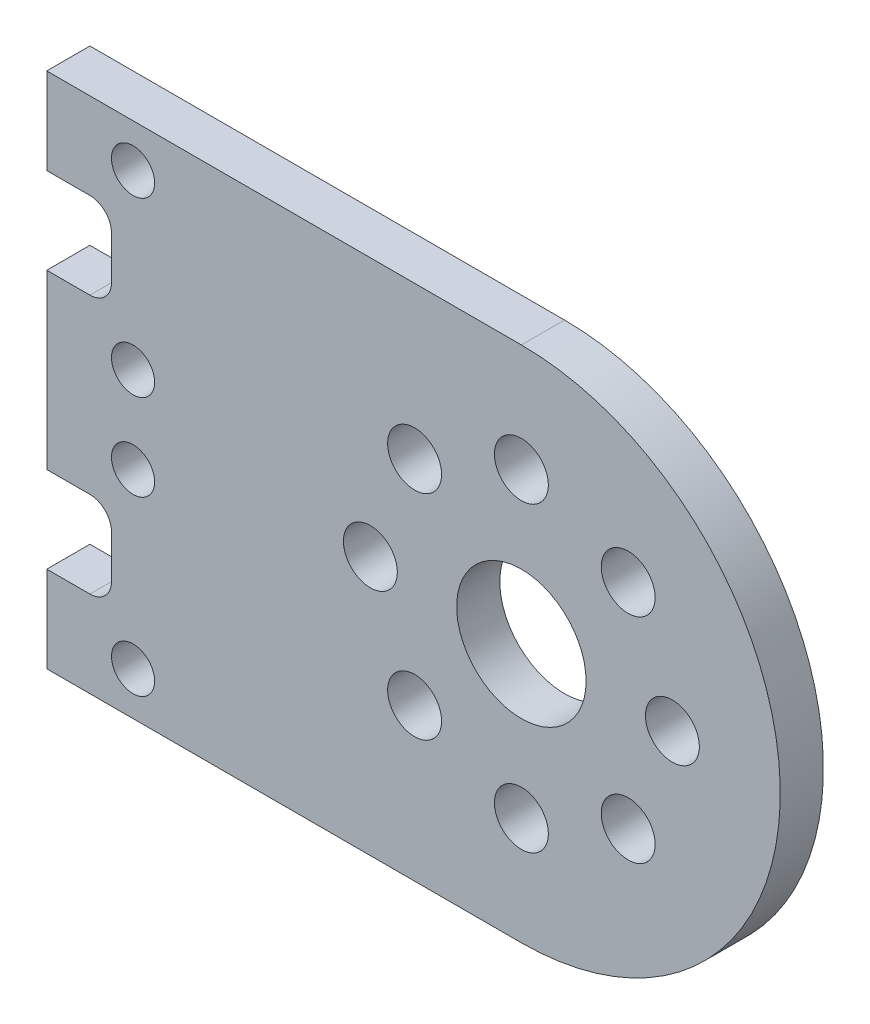
from build123d import *

# Parameters (mm, degrees)
SKETCH_8_R      = 1.25
SKETCH_8_R_2    = 3
SKETCH_8_R_3    = 1
EXTRUDE_1_DEPTH = 2


with BuildPart() as part:
    # 草圖8 → 填料-伸長1 (new body)
    with BuildSketch(Plane.XY):
        with BuildLine():
            Line((-25.40478598, 11.861352689), (-25.40478598, 7.861352689))
            Line((-25.40478598, 7.861352689), (-23.40478598, 7.861352689))
            ThreePointArc((-23.40478598, 7.861352689), (-22.697679198, 7.56845947), (-22.40478598, 6.861352689))
            Line((-22.40478598, 6.861352689), (-22.40478598, 4.861352689))
            ThreePointArc((-22.40478598, 4.861352689), (-22.697679198, 4.154245908), (-23.40478598, 3.861352689))
            Line((-23.40478598, 3.861352689), (-25.40478598, 3.861352689))
            Line((-25.40478598, 3.861352689), (-25.40478598, -4.138647311))
            Line((-25.40478598, -4.138647311), (-23.40478598, -4.138647311))
            ThreePointArc((-23.40478598, -4.138647311), (-22.697679198, -4.43154053), (-22.40478598, -5.138647311))
            Line((-22.40478598, -5.138647311), (-22.40478598, -7.138647311))
            ThreePointArc((-22.40478598, -7.138647311), (-22.697679198, -7.845754092), (-23.40478598, -8.138647311))
            Line((-23.40478598, -8.138647311), (-25.40478598, -8.138647311))
            Line((-25.40478598, -8.138647311), (-25.40478598, -12.138647311))
            Line((-25.40478598, -12.138647311), (-3.40478598, -12.138647311))
            ThreePointArc((-3.40478598, -12.138647311), (8.59521402, -0.138647311), (-3.40478598, 11.861352689))
            Line((-3.40478598, 11.861352689), (-25.40478598, 11.861352689))
        make_face()
        with Locations((-3.40478598, 6.861352689)):
            Circle(SKETCH_8_R, mode=Mode.SUBTRACT)
        with Locations((1.544961489, 4.811100157)):
            Circle(SKETCH_8_R, mode=Mode.SUBTRACT)
        with Locations((-3.40478598, -0.138647311)):
            Circle(SKETCH_8_R_2, mode=Mode.SUBTRACT)
        with Locations((3.59521402, -0.138647311)):
            Circle(SKETCH_8_R, mode=Mode.SUBTRACT)
        with Locations((1.544961489, -5.08839478)):
            Circle(SKETCH_8_R, mode=Mode.SUBTRACT)
        with Locations((-3.40478598, -7.138647311)):
            Circle(SKETCH_8_R, mode=Mode.SUBTRACT)
        with Locations((-8.354533448, -5.08839478)):
            Circle(SKETCH_8_R, mode=Mode.SUBTRACT)
        with Locations((-10.40478598, -0.138647311)):
            Circle(SKETCH_8_R, mode=Mode.SUBTRACT)
        with Locations((-8.354533448, 4.811100157)):
            Circle(SKETCH_8_R, mode=Mode.SUBTRACT)
        with Locations((-21.40478598, 9.861352689)):
            Circle(SKETCH_8_R_3, mode=Mode.SUBTRACT)
        with Locations((-21.40478598, 1.861352689)):
            Circle(SKETCH_8_R_3, mode=Mode.SUBTRACT)
        with Locations((-21.40478598, -2.138647311)):
            Circle(SKETCH_8_R_3, mode=Mode.SUBTRACT)
        with Locations((-21.40478598, -10.138647311)):
            Circle(SKETCH_8_R_3, mode=Mode.SUBTRACT)
    extrude(amount=EXTRUDE_1_DEPTH)


solid = part.part
